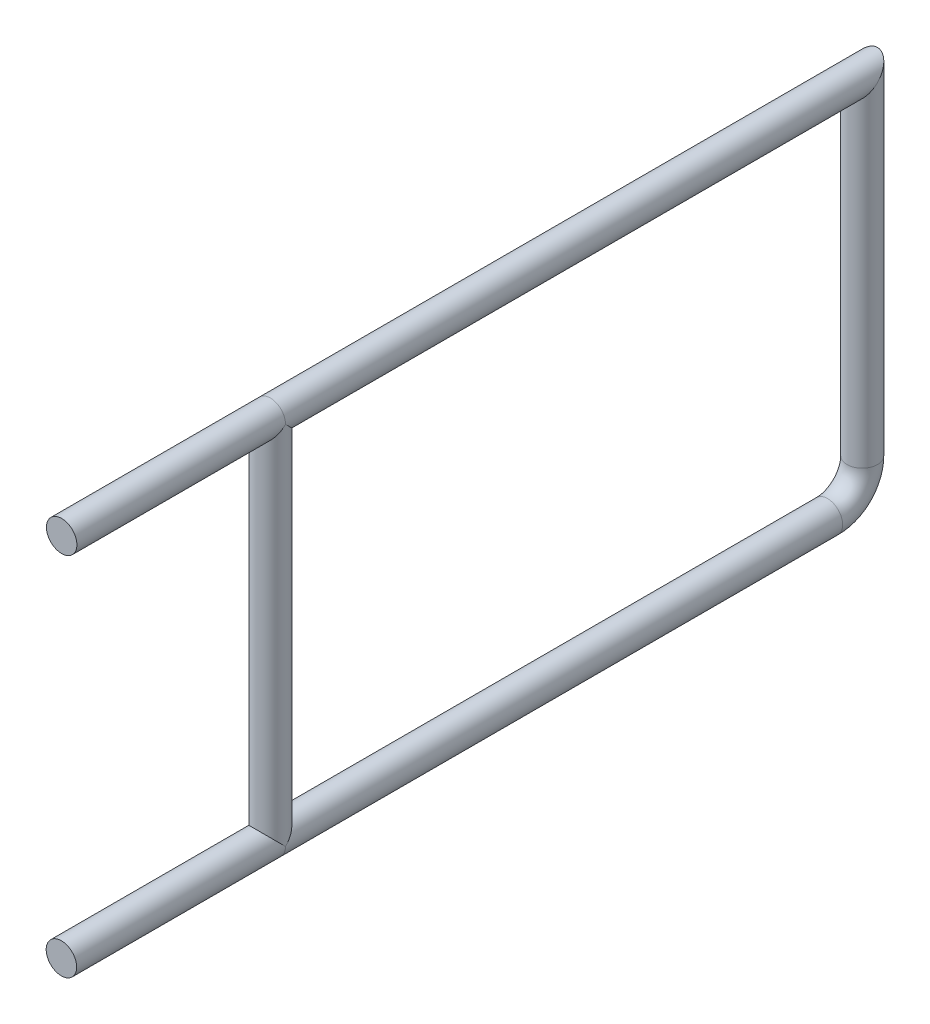
from build123d import *

# Parameters (mm, degrees)
SKETCH3_R   = 11.1125
SKETCH3_8_R = 11.1125


with BuildPart() as part:
    # Sweep1: sweep along a path in Sketch1
    with BuildLine(Plane(origin=(0, 0, 0), x_dir=(0, 0, -1), z_dir=(1, 0, 0))) as sweep1_path:
        Line((0, -431.8), (152.212779539, -431.8))
        Line((152.212779539, -431.8), (584.012779539, -431.8))
        Line((584.012779539, -431.8), (584.012779539, -673.1))
        ThreePointArc((584.012779539, -673.1), (576.573291781, -691.060512242), (558.612779539, -698.5))
        Line((558.612779539, -698.5), (152.212779539, -698.5))
        Line((152.212779539, -698.5), (-0.187220461, -698.5))
    # Sketch3 → Sweep1 (sweep)
    with BuildSketch(Plane.XY):
        with Locations((0, -698.5)):
            Circle(SKETCH3_R)
    sweep(path=sweep1_path.line, transition=Transition.RIGHT)

    # Sweep2: sweep along a path in Sketch1<23>
    with BuildLine(Plane(origin=(0, 0, 0), x_dir=(0, 0, -1), z_dir=(1, 0, 0))) as sweep2_path:
        Line((-0.187220461, -698.5), (152.212779539, -698.5))
        Line((152.212779539, -698.5), (152.212779539, -431.8))
    # Sketch3<8> → Sweep2 (sweep)
    with BuildSketch(Plane.XY):
        with Locations((0, -698.5)):
            Circle(SKETCH3_8_R)
    sweep(path=sweep2_path.line, transition=Transition.RIGHT)


solid = part.part
